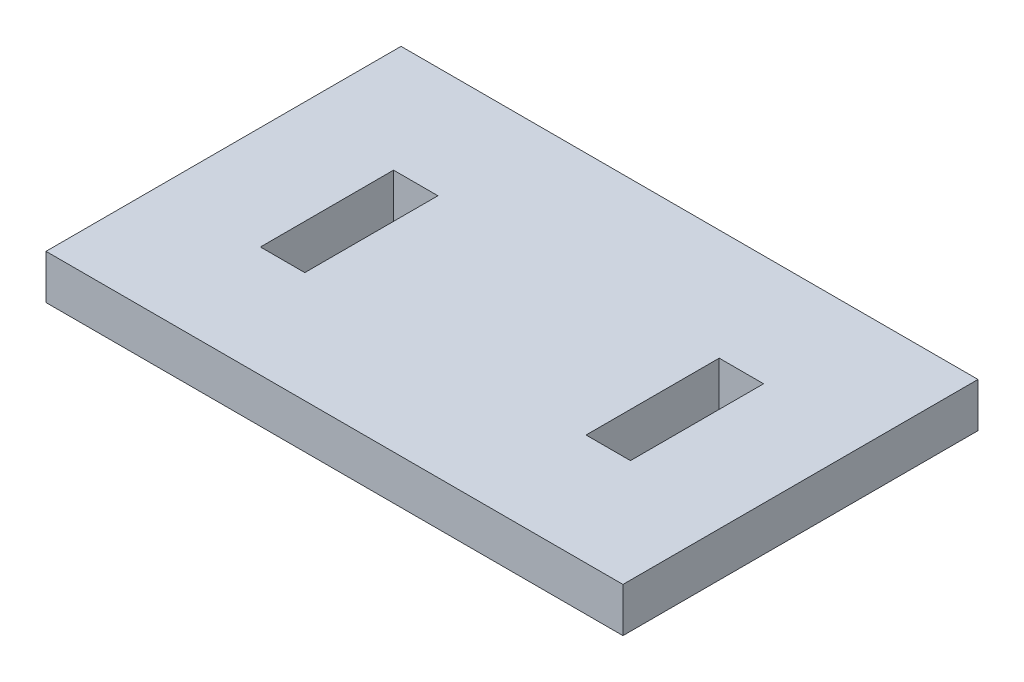
from build123d import *

# Parameters (mm, degrees)
SKETCH1_W           = 41.275
SKETCH1_H           = 25.4
SKETCH1_W_2         = 3.175
SKETCH1_H_2         = 9.525
BOSS_EXTRUDE1_DEPTH = 3.175


with BuildPart() as part:
    # Sketch1 → Boss-Extrude1 (new body)
    with BuildSketch(Plane(origin=(0, 0, 0), x_dir=(1, 0, 0), z_dir=(0, 1, 0))):
        with Locations((20.6375, 12.7)):
            Rectangle(SKETCH1_W, SKETCH1_H)
        with Locations((8.988805871, 12.7)):
            Rectangle(SKETCH1_W_2, SKETCH1_H_2, mode=Mode.SUBTRACT)
        with Locations((32.286194129, 12.7)):
            Rectangle(SKETCH1_W_2, SKETCH1_H_2, mode=Mode.SUBTRACT)
    extrude(amount=BOSS_EXTRUDE1_DEPTH)


solid = part.part
